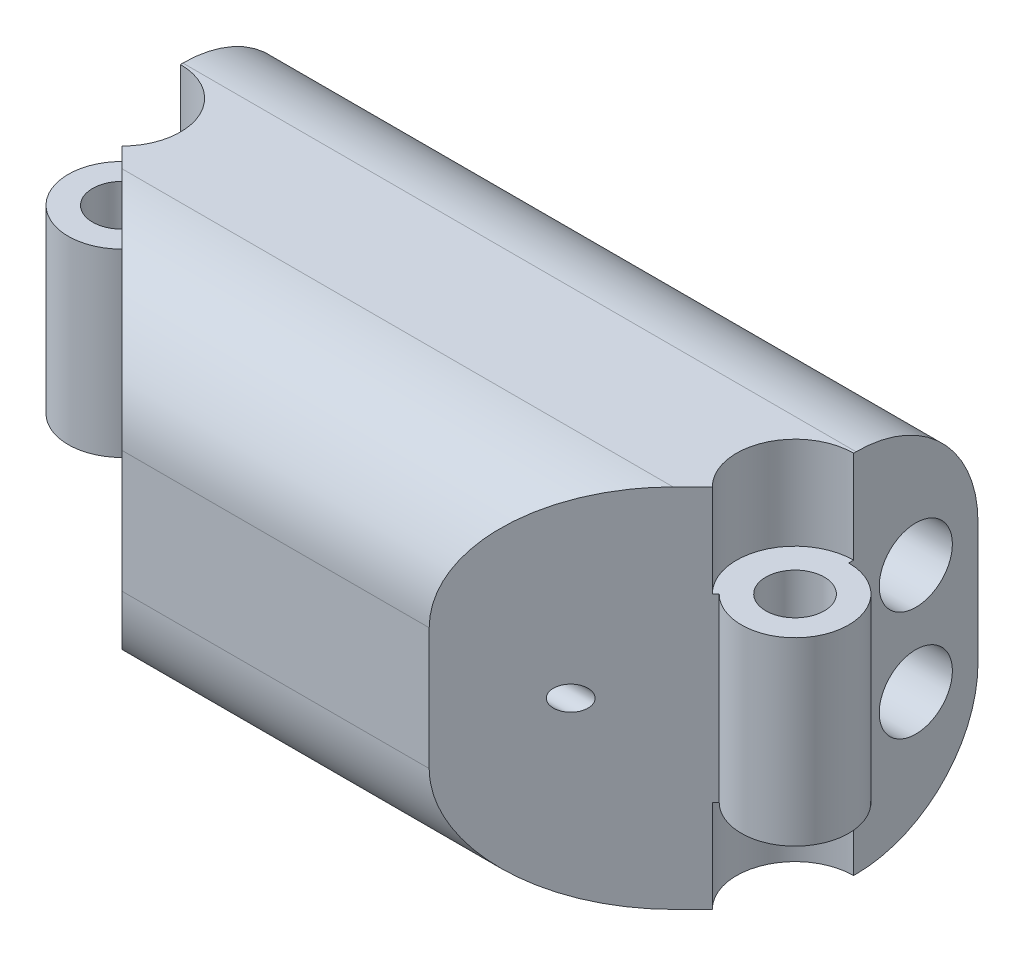
from build123d import *

# Parameters (mm, degrees)
BOSS_EXTRUDE1_DEPTH            = 7.5
BOSS_EXTRUDE1_DEPTH_BACK       = 7.5
CUT_EXTRUDE3_REACH             = 31.568
SKETCH5_R                      = 1.5
FILLET1_R                      = 5
CUT_EXTRUDE2_REACH             = 19.405
SKETCH3_R                      = 0.5
CUT_EXTRUDE2_DIRECTION_2_REACH = 19.405
FILLET2_R                      = 5
BOSS_EXTRUDE2_DEPTH            = 3.7
BOSS_EXTRUDE2_DEPTH_BACK       = 3.7
SKETCH6_R                      = 1.2


with BuildPart() as part:
    # Sketch1 → Boss-Extrude1 (new, two sides: drawn at the far end of the back side and taken through both)
    with BuildSketch(Plane(origin=(0, 0, 0), x_dir=(-1, 0, 0), z_dir=(0, 1, 0)).offset(-BOSS_EXTRUDE1_DEPTH_BACK)):
        with BuildLine():
            Line((6.3, 7.5), (-6.3, 7.5))
            Line((-6.3, 7.5), (-12.102943725, 1.697056275))
            ThreePointArc((-12.102943725, 1.697056275), (-11.582689122, -0.918440238), (-13.8, -2.4))
            Line((-13.8, -2.4), (-13.8, -7.5))
            Line((-13.8, -7.5), (13.8, -7.5))
            Line((13.8, -7.5), (13.8, -2.4))
            ThreePointArc((13.8, -2.4), (11.582689122, -0.918440238), (12.102943725, 1.697056275))
            Line((12.102943725, 1.697056275), (6.3, 7.5))
        make_face()
    extrude(amount=BOSS_EXTRUDE1_DEPTH + BOSS_EXTRUDE1_DEPTH_BACK)

    # Sketch5 → Cut-Extrude3 (cut, up to next)
    with BuildSketch(Plane.YZ.offset(13.8), mode=Mode.PRIVATE) as cut_extrude3_sk1:
        with Locations((-2.25, -4.95)):
            Circle(SKETCH5_R)
    cut_extrude3_tool1 = extrude(cut_extrude3_sk1.sketch, amount=-CUT_EXTRUDE3_REACH, mode=Mode.PRIVATE) & part.part
    # Sketch5 → Cut-Extrude3 (cut, up to next)
    with BuildSketch(Plane.YZ.offset(13.8), mode=Mode.PRIVATE) as cut_extrude3_sk2:
        with Locations((2.25, -4.95)):
            Circle(SKETCH5_R)
    cut_extrude3_tool2 = extrude(cut_extrude3_sk2.sketch, amount=-CUT_EXTRUDE3_REACH, mode=Mode.PRIVATE) & part.part
    add(cut_extrude3_tool1.solids().sort_by_distance((13.8, -2.25, -4.95))[0], mode=Mode.SUBTRACT)
    add(cut_extrude3_tool2.solids().sort_by_distance((13.8, 2.25, -4.95))[0], mode=Mode.SUBTRACT)

    # Fillet1
    fillet1_edges = [part.edges().sort_by_distance(p)[0] for p in [
        (0, -7.5, -7.5),
        (0, 7.5, -7.5),
    ]]
    fillet(fillet1_edges, radius=FILLET1_R)

    # Sketch3 → Cut-Extrude2 (cut, up to next)
    with BuildSketch(Plane.YZ, mode=Mode.PRIVATE) as cut_extrude2_sk1:
        with Locations((0, 4.598528137)):
            Circle(SKETCH3_R)
    cut_extrude2_tool1 = extrude(cut_extrude2_sk1.sketch, amount=-CUT_EXTRUDE2_REACH, mode=Mode.PRIVATE) & part.part
    add(cut_extrude2_tool1.solids().sort_by_distance((0, 0, 4.598528))[0], mode=Mode.SUBTRACT)

    # Sketch3 → Cut-Extrude2 direction 2 (cut, up to next)
    with BuildSketch(Plane.YZ, mode=Mode.PRIVATE) as cut_extrude2_direction_2_sk1:
        with Locations((0, 4.598528137)):
            Circle(SKETCH3_R)
    cut_extrude2_direction_2_tool1 = extrude(cut_extrude2_direction_2_sk1.sketch, amount=CUT_EXTRUDE2_DIRECTION_2_REACH, mode=Mode.PRIVATE) & part.part
    add(cut_extrude2_direction_2_tool1.solids().sort_by_distance((0, 0, 4.598528))[0], mode=Mode.SUBTRACT)

    # Fillet2
    fillet2_edges = [part.edges().sort_by_distance(p)[0] for p in [
        (0, 7.5, 7.5),
        (0, -7.5, 7.5),
    ]]
    fillet(fillet2_edges, radius=FILLET2_R)

    # Sketch6 → Boss-Extrude2 (add, two sides: drawn at the far end of the back side and taken through both)
    # profile 1 of 2: a face of its own
    with BuildSketch(Plane(origin=(0, 0, 0), x_dir=(-1, 0, 0), z_dir=(0, 1, 0)).offset(-BOSS_EXTRUDE2_DEPTH_BACK)):
        with BuildLine():
            Line((-12.102943725, 1.697056275), (-12.244365081, 1.555634919))
            ThreePointArc((-12.244365081, 1.555634919), (-15.832534972, 0.841903551), (-13.8, -2.2))
            Line((-13.8, -2.2), (-13.8, -2.4))
            ThreePointArc((-13.8, -2.4), (-11.582689122, -0.918440238), (-12.102943725, 1.697056275))
        make_face()
        with Locations((-13.8, 0)):
            Circle(SKETCH6_R, mode=Mode.SUBTRACT)
    # profile 2 of 2: a face of its own
    with BuildSketch(Plane(origin=(0, 0, 0), x_dir=(-1, 0, 0), z_dir=(0, 1, 0)).offset(-BOSS_EXTRUDE2_DEPTH_BACK)):
        with BuildLine():
            Line((13.8, -2.4), (13.8, -2.2))
            ThreePointArc((13.8, -2.2), (15.832534972, 0.841903551), (12.244365081, 1.555634919))
            Line((12.244365081, 1.555634919), (12.102943725, 1.697056275))
            ThreePointArc((12.102943725, 1.697056275), (11.582689122, -0.918440238), (13.8, -2.4))
        make_face()
        with Locations((13.8, 0)):
            Circle(SKETCH6_R, mode=Mode.SUBTRACT)
    extrude(amount=BOSS_EXTRUDE2_DEPTH + BOSS_EXTRUDE2_DEPTH_BACK)


solid = part.part
